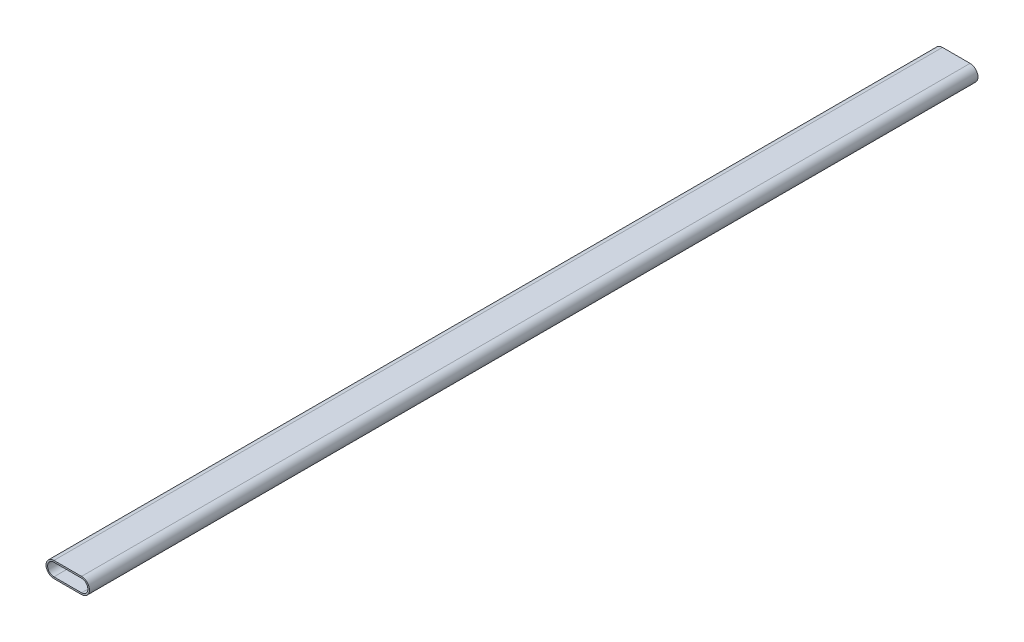
from build123d import *

# Parameters (mm, degrees)
BOSS_EXTRUDE1_DEPTH = 675


with BuildPart() as part:
    # Sketch1 → Boss-Extrude1 (new body)
    with BuildSketch(Plane.XY):
        with BuildLine():
            Line((0, 6), (21, 6))
            ThreePointArc((21, 6), (27, 0), (21, -6))
            Line((21, -6), (0, -6))
            ThreePointArc((0, -6), (-6, 0), (0, 6))
        make_face()
        with BuildLine():
            Line((0, 4.8), (21, 4.8))
            ThreePointArc((21, 4.8), (25.8, 0), (21, -4.8))
            Line((21, -4.8), (0, -4.8))
            ThreePointArc((0, -4.8), (-4.8, 0), (0, 4.8))
        make_face(mode=Mode.SUBTRACT)
    extrude(amount=BOSS_EXTRUDE1_DEPTH)


solid = part.part
